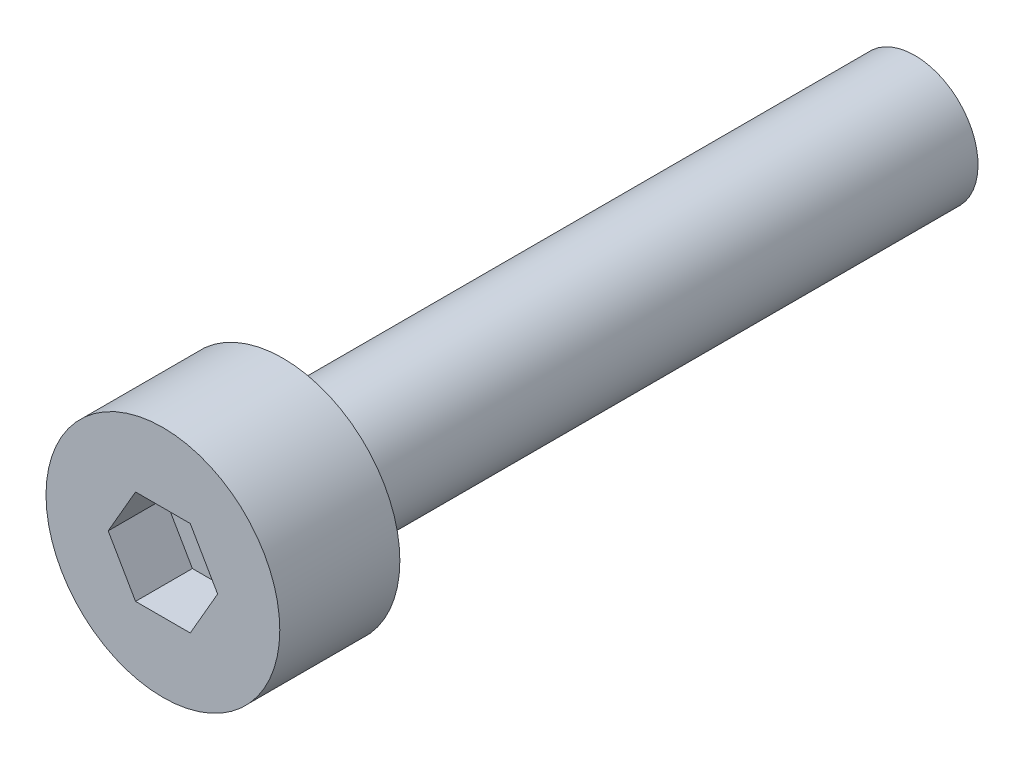
from build123d import *

# Parameters (mm, degrees)
CUT_EXTRUDE_1_DEPTH = 0.9


with BuildPart() as part:
    # 草图1 → 旋转1 (revolve)
    with BuildSketch(Plane(origin=(0, 0, 0), x_dir=(0, 0, -1), z_dir=(1, 0, 0))):
        Polygon((0, 0), (0, 1.85), (1.9, 1.85), (1.9, 1), (11.9, 1), (11.9, 0), align=None)
    revolve(axis=Axis((0, 0, -11.9), (0, 0, 1)))

    # 草图2 → 切除-拉伸1 (cut)
    with BuildSketch(Plane.XY):
        Polygon((0.433012702, 0.75), (-0.433012702, 0.75), (-0.866025404, 0), (-0.433012702, -0.75), (0.433012702, -0.75), (0.866025404, 0), align=None)
    extrude(amount=-CUT_EXTRUDE_1_DEPTH, mode=Mode.SUBTRACT)


solid = part.part
